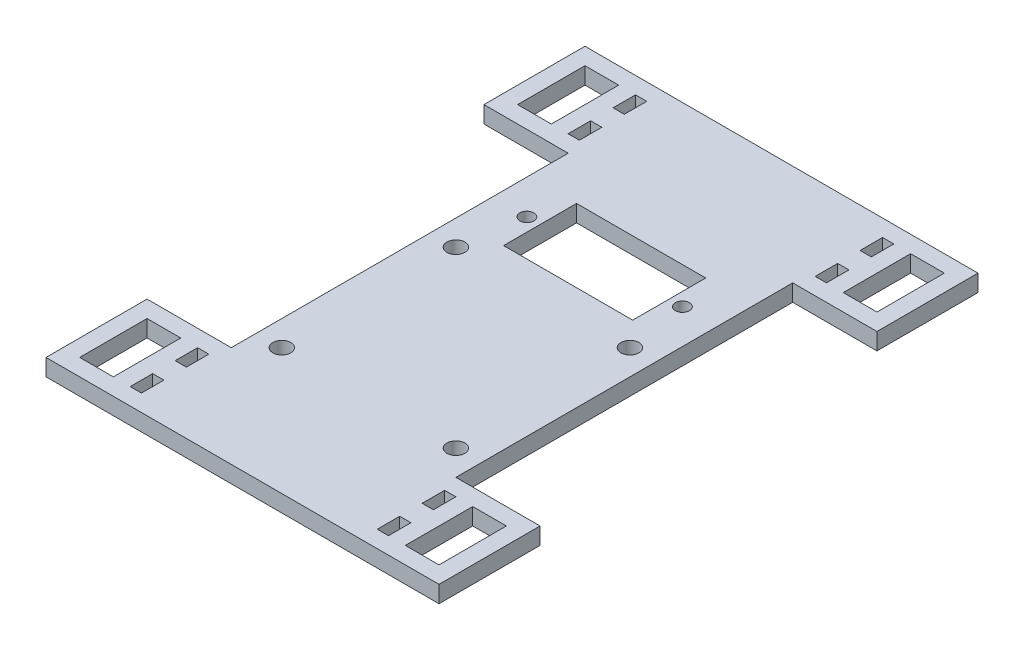
from build123d import *

# Parameters (mm, degrees)
EXTRUDE_1_DEPTH     = 3
CUT_EXTRUDE_1_REACH = 69.809
SKETCH_2_R          = 1.6
SKETCH_2_R_2        = 1.25
SKETCH_2_W          = 23
SKETCH_2_H          = 13
SKETCH_2_W_2        = 2
SKETCH_2_H_2        = 4
SKETCH_2_W_3        = 6
SKETCH_2_H_3        = 12


with BuildPart() as part:
    # 草图1 → 凸台-拉伸1 (new body)
    with BuildSketch(Plane(origin=(0, 0, 0), x_dir=(1, 0, 0), z_dir=(0, 1, 0))):
        Polygon((20, -20), (35, -20), (35, -38), (-35, -38), (-35, -20), (-20, -20), (-20, 20), (-20, 40), (-35, 40), (-35, 58), (35, 58), (35, 40), (20, 40), (20, 20), align=None)
    extrude(amount=EXTRUDE_1_DEPTH)

    # 草图2 → 切除-拉伸1 (cut, up to next)
    with BuildSketch(Plane(origin=(0, 3, 0), x_dir=(1, 0, 0), z_dir=(0, 1, 0)), mode=Mode.PRIVATE) as cut_extrude_1_sk1:
        with Locations(Location((-15.5, -15.5, 0), (0, 0, 270))):
            Circle(SKETCH_2_R)
    cut_extrude_1_tool1 = extrude(cut_extrude_1_sk1.sketch, amount=-CUT_EXTRUDE_1_REACH, mode=Mode.PRIVATE) & part.part
    # 草图2 → 切除-拉伸1 (cut, up to next)
    with BuildSketch(Plane(origin=(0, 3, 0), x_dir=(1, 0, 0), z_dir=(0, 1, 0)), mode=Mode.PRIVATE) as cut_extrude_1_sk2:
        with Locations(Location((-15.5, 15.5, 0), (0, 0, 270))):
            Circle(SKETCH_2_R)
    cut_extrude_1_tool2 = extrude(cut_extrude_1_sk2.sketch, amount=-CUT_EXTRUDE_1_REACH, mode=Mode.PRIVATE) & part.part
    # 草图2 → 切除-拉伸1 (cut, up to next)
    with BuildSketch(Plane(origin=(0, 3, 0), x_dir=(1, 0, 0), z_dir=(0, 1, 0)), mode=Mode.PRIVATE) as cut_extrude_1_sk3:
        with Locations(Location((15.5, -15.5, 0), (0, 0, 270))):
            Circle(SKETCH_2_R)
    cut_extrude_1_tool3 = extrude(cut_extrude_1_sk3.sketch, amount=-CUT_EXTRUDE_1_REACH, mode=Mode.PRIVATE) & part.part
    # 草图2 → 切除-拉伸1 (cut, up to next)
    with BuildSketch(Plane(origin=(0, 3, 0), x_dir=(1, 0, 0), z_dir=(0, 1, 0)), mode=Mode.PRIVATE) as cut_extrude_1_sk4:
        with Locations(Location((15.5, 15.5, 0), (0, 0, 270))):
            Circle(SKETCH_2_R)
    cut_extrude_1_tool4 = extrude(cut_extrude_1_sk4.sketch, amount=-CUT_EXTRUDE_1_REACH, mode=Mode.PRIVATE) & part.part
    # 草图2 → 切除-拉伸1 (cut, up to next)
    with BuildSketch(Plane(origin=(0, 3, 0), x_dir=(1, 0, 0), z_dir=(0, 1, 0)), mode=Mode.PRIVATE) as cut_extrude_1_sk5:
        with Locations(Location((-13.85, 26.5, 0), (0, 0, 270))):
            Circle(SKETCH_2_R_2)
    cut_extrude_1_tool5 = extrude(cut_extrude_1_sk5.sketch, amount=-CUT_EXTRUDE_1_REACH, mode=Mode.PRIVATE) & part.part
    # 草图2 → 切除-拉伸1 (cut, up to next)
    with BuildSketch(Plane(origin=(0, 3, 0), x_dir=(1, 0, 0), z_dir=(0, 1, 0)), mode=Mode.PRIVATE) as cut_extrude_1_sk6:
        with Locations(Location((13.85, 26.5, 0), (0, 0, 270))):
            Circle(SKETCH_2_R_2)
    cut_extrude_1_tool6 = extrude(cut_extrude_1_sk6.sketch, amount=-CUT_EXTRUDE_1_REACH, mode=Mode.PRIVATE) & part.part
    # 草图2 → 切除-拉伸1 (cut, up to next)
    with BuildSketch(Plane(origin=(0, 3, 0), x_dir=(1, 0, 0), z_dir=(0, 1, 0)), mode=Mode.PRIVATE) as cut_extrude_1_sk7:
        with Locations((0, 26.5)):
            Rectangle(SKETCH_2_W, SKETCH_2_H)
    cut_extrude_1_tool7 = extrude(cut_extrude_1_sk7.sketch, amount=-CUT_EXTRUDE_1_REACH, mode=Mode.PRIVATE) & part.part
    # 草图2 → 切除-拉伸1 (cut, up to next)
    with BuildSketch(Plane(origin=(0, 3, 0), x_dir=(1, 0, 0), z_dir=(0, 1, 0)), mode=Mode.PRIVATE) as cut_extrude_1_sk8:
        with Locations((-22, -33)):
            Rectangle(SKETCH_2_W_2, SKETCH_2_H_2)
    cut_extrude_1_tool8 = extrude(cut_extrude_1_sk8.sketch, amount=-CUT_EXTRUDE_1_REACH, mode=Mode.PRIVATE) & part.part
    # 草图2 → 切除-拉伸1 (cut, up to next)
    with BuildSketch(Plane(origin=(0, 3, 0), x_dir=(1, 0, 0), z_dir=(0, 1, 0)), mode=Mode.PRIVATE) as cut_extrude_1_sk9:
        with Locations((-29, -29)):
            Rectangle(SKETCH_2_W_3, SKETCH_2_H_3)
    cut_extrude_1_tool9 = extrude(cut_extrude_1_sk9.sketch, amount=-CUT_EXTRUDE_1_REACH, mode=Mode.PRIVATE) & part.part
    # 草图2 → 切除-拉伸1 (cut, up to next)
    with BuildSketch(Plane(origin=(0, 3, 0), x_dir=(1, 0, 0), z_dir=(0, 1, 0)), mode=Mode.PRIVATE) as cut_extrude_1_sk10:
        with Locations((-22, -25)):
            Rectangle(SKETCH_2_W_2, SKETCH_2_H_2)
    cut_extrude_1_tool10 = extrude(cut_extrude_1_sk10.sketch, amount=-CUT_EXTRUDE_1_REACH, mode=Mode.PRIVATE) & part.part
    # 草图2 → 切除-拉伸1 (cut, up to next)
    with BuildSketch(Plane(origin=(0, 3, 0), x_dir=(1, 0, 0), z_dir=(0, 1, 0)), mode=Mode.PRIVATE) as cut_extrude_1_sk11:
        with Locations((22, -33)):
            Rectangle(SKETCH_2_W_2, SKETCH_2_H_2)
    cut_extrude_1_tool11 = extrude(cut_extrude_1_sk11.sketch, amount=-CUT_EXTRUDE_1_REACH, mode=Mode.PRIVATE) & part.part
    # 草图2 → 切除-拉伸1 (cut, up to next)
    with BuildSketch(Plane(origin=(0, 3, 0), x_dir=(1, 0, 0), z_dir=(0, 1, 0)), mode=Mode.PRIVATE) as cut_extrude_1_sk12:
        with Locations((22, -25)):
            Rectangle(SKETCH_2_W_2, SKETCH_2_H_2)
    cut_extrude_1_tool12 = extrude(cut_extrude_1_sk12.sketch, amount=-CUT_EXTRUDE_1_REACH, mode=Mode.PRIVATE) & part.part
    # 草图2 → 切除-拉伸1 (cut, up to next)
    with BuildSketch(Plane(origin=(0, 3, 0), x_dir=(1, 0, 0), z_dir=(0, 1, 0)), mode=Mode.PRIVATE) as cut_extrude_1_sk13:
        with Locations((29, -29)):
            Rectangle(SKETCH_2_W_3, SKETCH_2_H_3)
    cut_extrude_1_tool13 = extrude(cut_extrude_1_sk13.sketch, amount=-CUT_EXTRUDE_1_REACH, mode=Mode.PRIVATE) & part.part
    # 草图2 → 切除-拉伸1 (cut, up to next)
    with BuildSketch(Plane(origin=(0, 3, 0), x_dir=(1, 0, 0), z_dir=(0, 1, 0)), mode=Mode.PRIVATE) as cut_extrude_1_sk14:
        with Locations((-22, 45)):
            Rectangle(SKETCH_2_W_2, SKETCH_2_H_2)
    cut_extrude_1_tool14 = extrude(cut_extrude_1_sk14.sketch, amount=-CUT_EXTRUDE_1_REACH, mode=Mode.PRIVATE) & part.part
    # 草图2 → 切除-拉伸1 (cut, up to next)
    with BuildSketch(Plane(origin=(0, 3, 0), x_dir=(1, 0, 0), z_dir=(0, 1, 0)), mode=Mode.PRIVATE) as cut_extrude_1_sk15:
        with Locations((-29, 49)):
            Rectangle(SKETCH_2_W_3, SKETCH_2_H_3)
    cut_extrude_1_tool15 = extrude(cut_extrude_1_sk15.sketch, amount=-CUT_EXTRUDE_1_REACH, mode=Mode.PRIVATE) & part.part
    # 草图2 → 切除-拉伸1 (cut, up to next)
    with BuildSketch(Plane(origin=(0, 3, 0), x_dir=(1, 0, 0), z_dir=(0, 1, 0)), mode=Mode.PRIVATE) as cut_extrude_1_sk16:
        with Locations((-22, 53)):
            Rectangle(SKETCH_2_W_2, SKETCH_2_H_2)
    cut_extrude_1_tool16 = extrude(cut_extrude_1_sk16.sketch, amount=-CUT_EXTRUDE_1_REACH, mode=Mode.PRIVATE) & part.part
    # 草图2 → 切除-拉伸1 (cut, up to next)
    with BuildSketch(Plane(origin=(0, 3, 0), x_dir=(1, 0, 0), z_dir=(0, 1, 0)), mode=Mode.PRIVATE) as cut_extrude_1_sk17:
        with Locations((22, 45)):
            Rectangle(SKETCH_2_W_2, SKETCH_2_H_2)
    cut_extrude_1_tool17 = extrude(cut_extrude_1_sk17.sketch, amount=-CUT_EXTRUDE_1_REACH, mode=Mode.PRIVATE) & part.part
    # 草图2 → 切除-拉伸1 (cut, up to next)
    with BuildSketch(Plane(origin=(0, 3, 0), x_dir=(1, 0, 0), z_dir=(0, 1, 0)), mode=Mode.PRIVATE) as cut_extrude_1_sk18:
        with Locations((22, 53)):
            Rectangle(SKETCH_2_W_2, SKETCH_2_H_2)
    cut_extrude_1_tool18 = extrude(cut_extrude_1_sk18.sketch, amount=-CUT_EXTRUDE_1_REACH, mode=Mode.PRIVATE) & part.part
    # 草图2 → 切除-拉伸1 (cut, up to next)
    with BuildSketch(Plane(origin=(0, 3, 0), x_dir=(1, 0, 0), z_dir=(0, 1, 0)), mode=Mode.PRIVATE) as cut_extrude_1_sk19:
        with Locations((29, 49)):
            Rectangle(SKETCH_2_W_3, SKETCH_2_H_3)
    cut_extrude_1_tool19 = extrude(cut_extrude_1_sk19.sketch, amount=-CUT_EXTRUDE_1_REACH, mode=Mode.PRIVATE) & part.part
    add(cut_extrude_1_tool1.solids().sort_by_distance((-15.5, 3, 15.5))[0], mode=Mode.SUBTRACT)
    add(cut_extrude_1_tool2.solids().sort_by_distance((-15.5, 3, -15.5))[0], mode=Mode.SUBTRACT)
    add(cut_extrude_1_tool3.solids().sort_by_distance((15.5, 3, 15.5))[0], mode=Mode.SUBTRACT)
    add(cut_extrude_1_tool4.solids().sort_by_distance((15.5, 3, -15.5))[0], mode=Mode.SUBTRACT)
    add(cut_extrude_1_tool5.solids().sort_by_distance((-13.85, 3, -26.5))[0], mode=Mode.SUBTRACT)
    add(cut_extrude_1_tool6.solids().sort_by_distance((13.85, 3, -26.5))[0], mode=Mode.SUBTRACT)
    add(cut_extrude_1_tool7.solids().sort_by_distance((0, 3, -26.5))[0], mode=Mode.SUBTRACT)
    add(cut_extrude_1_tool8.solids().sort_by_distance((-22, 3, 33))[0], mode=Mode.SUBTRACT)
    add(cut_extrude_1_tool9.solids().sort_by_distance((-29, 3, 29))[0], mode=Mode.SUBTRACT)
    add(cut_extrude_1_tool10.solids().sort_by_distance((-22, 3, 25))[0], mode=Mode.SUBTRACT)
    add(cut_extrude_1_tool11.solids().sort_by_distance((22, 3, 33))[0], mode=Mode.SUBTRACT)
    add(cut_extrude_1_tool12.solids().sort_by_distance((22, 3, 25))[0], mode=Mode.SUBTRACT)
    add(cut_extrude_1_tool13.solids().sort_by_distance((29, 3, 29))[0], mode=Mode.SUBTRACT)
    add(cut_extrude_1_tool14.solids().sort_by_distance((-22, 3, -45))[0], mode=Mode.SUBTRACT)
    add(cut_extrude_1_tool15.solids().sort_by_distance((-29, 3, -49))[0], mode=Mode.SUBTRACT)
    add(cut_extrude_1_tool16.solids().sort_by_distance((-22, 3, -53))[0], mode=Mode.SUBTRACT)
    add(cut_extrude_1_tool17.solids().sort_by_distance((22, 3, -45))[0], mode=Mode.SUBTRACT)
    add(cut_extrude_1_tool18.solids().sort_by_distance((22, 3, -53))[0], mode=Mode.SUBTRACT)
    add(cut_extrude_1_tool19.solids().sort_by_distance((29, 3, -49))[0], mode=Mode.SUBTRACT)


solid = part.part
